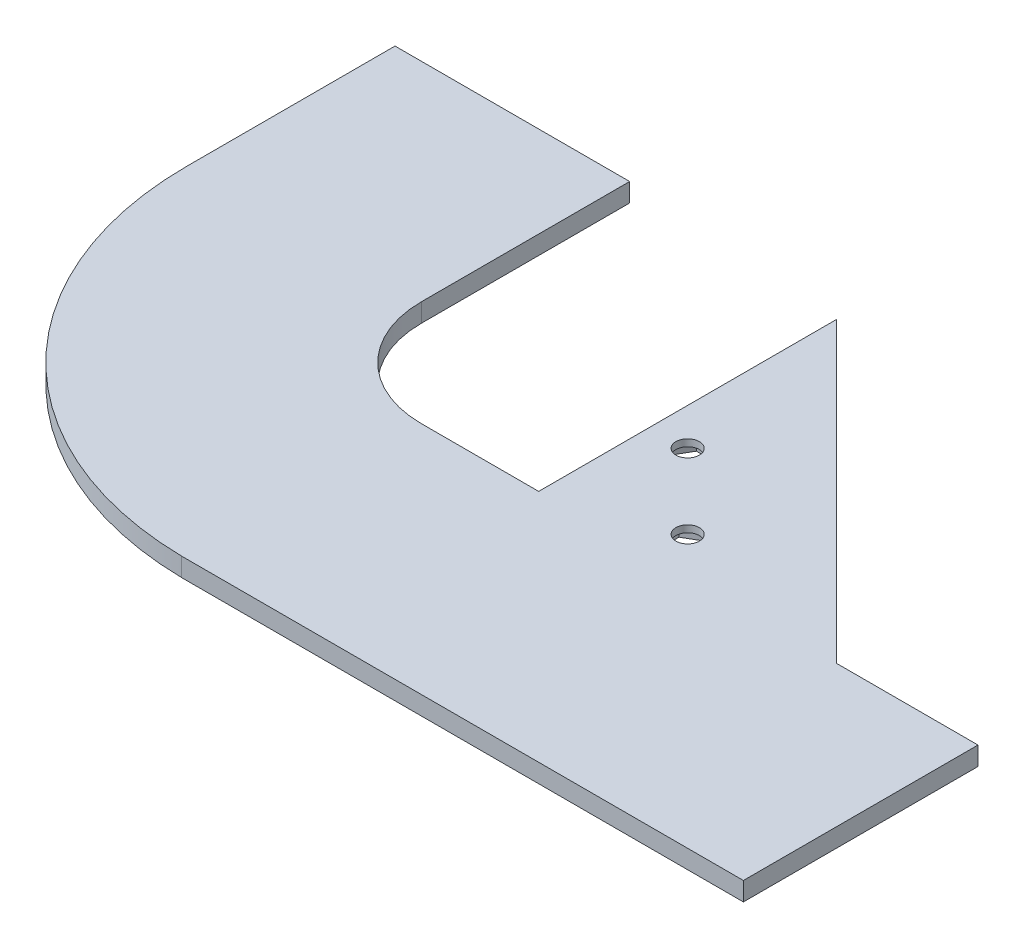
from build123d import *

# Parameters (mm, degrees)
BOSS_EXTRUDE1_DEPTH = 3.175
SKETCH2_R           = 2
CUT_EXTRUDE1_DEPTH  = 72.912172996
CUT_EXTRUDE2_START  = -3.175
CUT_EXTRUDE2_DEPTH  = 2
BOSS_EXTRUDE2_DEPTH = 3.175


with BuildPart() as part:
    # Sketch1 → Boss-Extrude1 (new body)
    with BuildSketch(Plane(origin=(0, 0, 0), x_dir=(1, 0, 0), z_dir=(0, 1, 0))):
        Polygon((0, 0), (50.8, 0), (0, 50.8), align=None)
    extrude(amount=BOSS_EXTRUDE1_DEPTH)

    # Sketch2 → Cut-Extrude1 (cut, through all)
    with BuildSketch(Plane(origin=(0, 3.175, 0), x_dir=(1, 0, 0), z_dir=(0, 1, 0))):
        with Locations(Location((19.05, 6.35, 0), (0, 0, 270))):
            Circle(SKETCH2_R)
        with Locations(Location((6.35, 19.05, 0), (0, 0, 90))):
            Circle(SKETCH2_R)
    extrude(amount=-CUT_EXTRUDE1_DEPTH, mode=Mode.SUBTRACT)

    # Sketch3 → Cut-Extrude2 (cut)
    with BuildSketch(Plane(origin=(0, 3.175, 0), x_dir=(1, 0, 0), z_dir=(0, 1, 0)).offset(CUT_EXTRUDE2_START)):
        Polygon((8.370723055, 15.550005), (10.391446111, 19.05), (8.370723055, 22.549995), (4.329276945, 22.549995), (2.308553889, 19.05), (4.329276945, 15.550005), align=None)
        Polygon((22.549995, 4.329276945), (19.05, 2.308553889), (15.550005, 4.329276945), (15.550005, 8.370723055), (19.05, 10.391446111), (22.549995, 8.370723055), align=None)
    extrude(amount=CUT_EXTRUDE2_DEPTH, mode=Mode.SUBTRACT)

    # Sketch4 → Boss-Extrude2 (add, through all)
    with BuildSketch(Plane(origin=(0, 0, 0), x_dir=(-1, 0, 0), z_dir=(0, -1, 0))):
        with BuildLine():
            Line((0, 0), (-74.904635469, 0))
            Line((-74.904635469, 0), (-74.904635469, -40))
            Line((-74.904635469, -40), (20.871249235, -40))
            ThreePointArc((20.871249235, -40), (61.323705254, -22.707621637), (78.006543383, 18))
            Line((78.006543383, 18), (78.006543383, 53.511510239))
            Line((78.006543383, 53.511510239), (38, 53.511510239))
            Line((38, 53.511510239), (38, 18))
            ThreePointArc((38, 18), (32.727922061, 5.272077939), (20, 0))
            Line((20, 0), (0, 0))
        make_face()
    extrude(amount=-BOSS_EXTRUDE2_DEPTH)


solid = part.part
